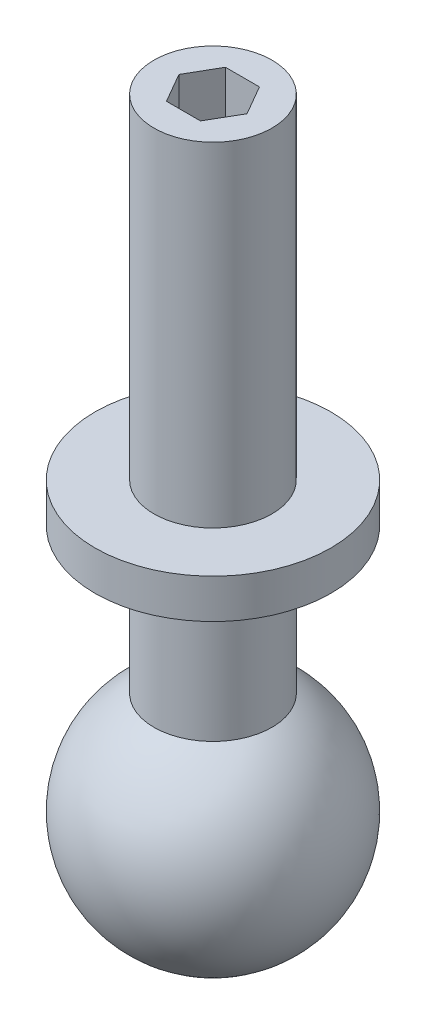
from build123d import *

# Parameters (mm, degrees)
M3_NECK_AND_THREAD_ENVELOPE_SKETCH_R = 1.5
M3_NECK_AND_THREAD_ENVELOPE_DEPTH    = 15.8
ANCHOR_SEATING_COLLAR_SKETCH_R       = 3
ANCHOR_SEATING_COLLAR_DEPTH          = 1
ANCHOR_TAIL_HEX_DRIVE_DEPTH          = 1.6


with BuildPart() as part:
    # M3 neck and thread envelope sketch → M3 neck and thread envelope (new body)
    with BuildSketch(Plane(origin=(0, -90, 0), x_dir=(-1, 0, 0), z_dir=(0, -1, 0))):
        with Locations(Location((23.382685902, 19, 0), (0, 0, 90))):
            Circle(M3_NECK_AND_THREAD_ENVELOPE_SKETCH_R)
    extrude(amount=M3_NECK_AND_THREAD_ENVELOPE_DEPTH)

    # Six millimetre anchor ball profile → Six millimetre anchor ball (revolve)
    with BuildSketch(Plane(origin=(0, -90, 0), x_dir=(-1, 0, 0), z_dir=(0, -1, 0))):
        with BuildLine():
            Line((23.382685902, 16), (23.382685902, 22))
            ThreePointArc((23.382685902, 22), (20.382685902, 19), (23.382685902, 16))
        make_face()
    revolve(axis=Axis((-23.382685902, -90, -29), (0, 0, 1)))

    # Anchor seating collar sketch → Anchor seating collar (add)
    with BuildSketch(Plane(origin=(0, -96.3, 0), x_dir=(-1, 0, 0), z_dir=(0, -1, 0))):
        with Locations(Location((23.382685902, 19, 0), (0, 0, 90))):
            Circle(ANCHOR_SEATING_COLLAR_SKETCH_R)
    extrude(amount=ANCHOR_SEATING_COLLAR_DEPTH)

    # Anchor tail hex drive sketch → Anchor tail hex drive (cut)
    with BuildSketch(Plane(origin=(0, -105.9, 0), x_dir=(1, 0, 0), z_dir=(0, 1, 0))):
        Polygon((-22.516660498, 19), (-22.9496732, 19.75), (-23.815698604, 19.75), (-24.248711306, 19), (-23.815698604, 18.25), (-22.9496732, 18.25), align=None)
    extrude(amount=ANCHOR_TAIL_HEX_DRIVE_DEPTH, mode=Mode.SUBTRACT)


with BuildPart() as body_2:
    # Mirror1: mirrored copy
    add(part.part.mirror(Plane(origin=(0, 0, 0), x_dir=(0, 0, 1), z_dir=(0, -1, 0))))


solid = body_2.part
